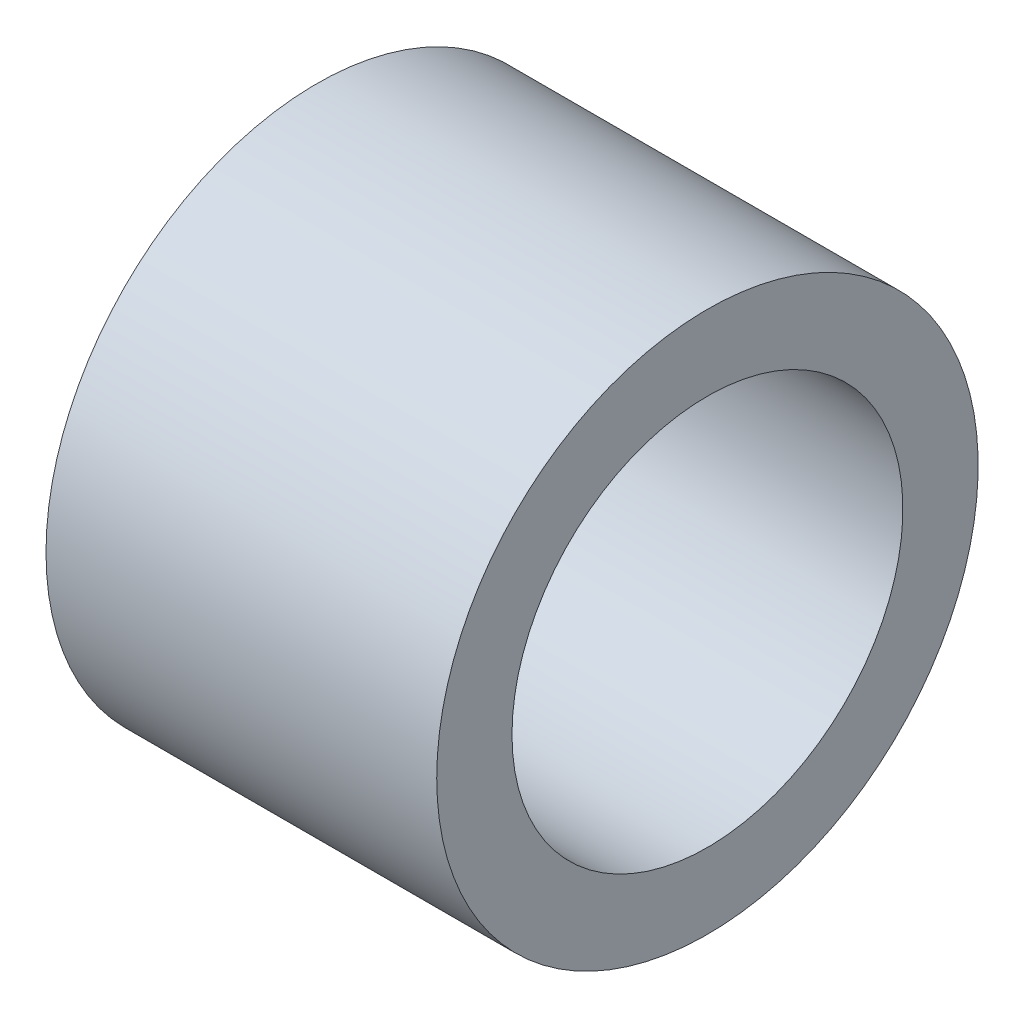
from build123d import *

# Parameters (mm, degrees)
SKETCH1_R           = 13.2
SKETCH1_R_2         = 9.53
BOSS_EXTRUDE1_DEPTH = 9.525


with BuildPart() as part:
    # Sketch1 → Boss-Extrude1 (new, symmetric)
    with BuildSketch(Plane(origin=(0, 0, 0), x_dir=(0, 0, -1), z_dir=(1, 0, 0))):
        Circle(SKETCH1_R)
        Circle(SKETCH1_R_2, mode=Mode.SUBTRACT)
    extrude(amount=BOSS_EXTRUDE1_DEPTH, both=True)


solid = part.part
